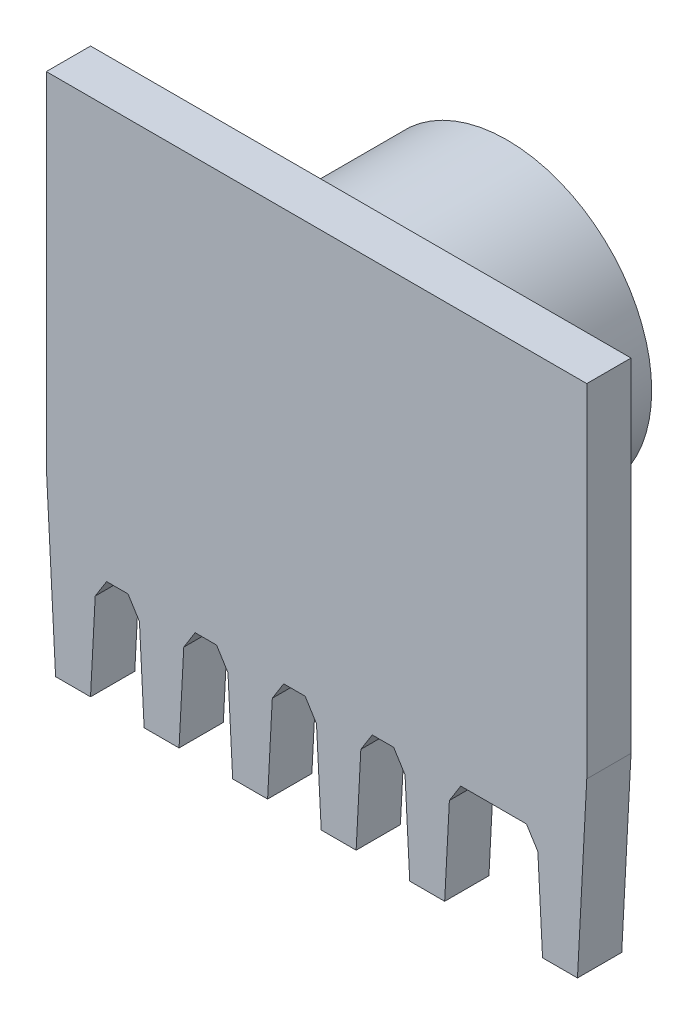
from build123d import *

# Parameters (mm, degrees)
BOSS_EXTRUDE1_DEPTH = 1.5
SKETCH10_R          = 4.9
BOSS_EXTRUDE2_DEPTH = 5


with BuildPart() as part:
    # Sketch1 → Boss-Extrude1 (new body)
    with BuildSketch(Plane.XY):
        Polygon((0, 6), (0.314446676, 0), (1.497941481, 0), (1.657221927, 3.039251967), (2.042586863, 3.65596478), (2.769801294, 3.65596478), (3.155166229, 3.039251967), (3.314446676, 0), (4.497941481, 0), (4.657221927, 3.039251967), (5.042586863, 3.65596478), (5.769801294, 3.65596478), (6.155166229, 3.039251967), (6.314446676, 0), (7.497941481, 0), (7.657221927, 3.039251967), (8.042586863, 3.65596478), (8.769801294, 3.65596478), (9.155166229, 3.039251967), (9.314446676, 0), (10.497941481, 0), (10.657221927, 3.039251967), (11.042586863, 3.65596478), (11.769801294, 3.65596478), (12.155166229, 3.039251967), (12.314446676, 0), (13.497941481, 0), (13.657221927, 3.039251967), (14.042586863, 3.65596478), (16.269801294, 3.65596478), (16.655166229, 3.039251967), (16.814446676, 0), (17.997941481, 0), (18.312388157, 6), (18.312388157, 17.6), (0, 17.6), align=None)
    extrude(amount=BOSS_EXTRUDE1_DEPTH)

    # Sketch10 → Boss-Extrude2 (add)
    with BuildSketch(Plane.XY):
        with Locations((9.112388157, 12)):
            Circle(SKETCH10_R)
    extrude(amount=-BOSS_EXTRUDE2_DEPTH)


solid = part.part
